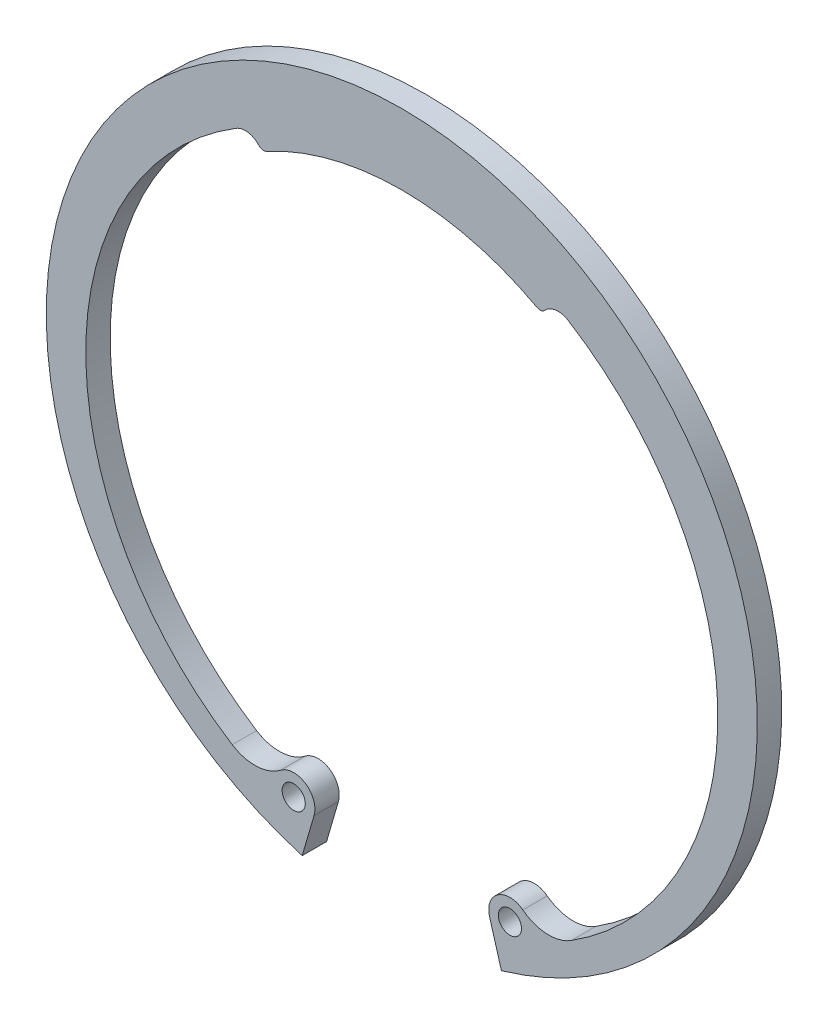
from build123d import *

# Parameters (mm, degrees)
SKETCH1_R           = 1.9
BOSS_EXTRUDE1_DEPTH = 4
BOSS_EXTRUDE2_DEPTH = 4
FILLET1_R           = 3
FILLET2_R           = 1


with BuildPart() as part:
    # Sketch1 → Boss-Extrude1 (new body)
    with BuildSketch(Plane.XY):
        with BuildLine():
            Line((16.350014, -56.012494518), (14.404736199, -49.348288471))
            ThreePointArc((14.404736199, -49.348288471), (15.780421817, -45.505146042), (19.860711038, -45.621311922))
            ThreePointArc((19.860711038, -45.621311922), (23.789076326, -47.057783014), (27.830450892, -45.979453446))
            ThreePointArc((27.830450892, -45.979453446), (0, 49.65), (-27.830450892, -45.979453446))
            ThreePointArc((-27.830450892, -45.979453446), (-23.789076326, -47.057783014), (-19.860711038, -45.621311922))
            ThreePointArc((-19.860711038, -45.621311922), (-15.780421817, -45.505146042), (-14.404736199, -49.348288471))
            Line((-14.404736199, -49.348288471), (-16.350014, -56.012494518))
            ThreePointArc((-16.350014, -56.012494518), (0, 58.35), (16.350014, -56.012494518))
        make_face()
        with Locations((17.740527432, -48.374572984)):
            Circle(SKETCH1_R, mode=Mode.SUBTRACT)
        with Locations((-17.740527432, -48.374572984)):
            Circle(SKETCH1_R, mode=Mode.SUBTRACT)
    extrude(amount=BOSS_EXTRUDE1_DEPTH)

    # Sketch2 → Boss-Extrude2 (add)
    with BuildSketch(Plane(origin=(0, 0, 0), x_dir=(-1, 0, 0), z_dir=(0, 0, -1))):
        with BuildLine():
            Line((23, 40.733405839), (24.5, 43.498463103))
            ThreePointArc((24.5, 43.498463103), (0, 49.65), (-24.5, 43.498463103))
            Line((-24.5, 43.498463103), (-23, 40.733405839))
            ThreePointArc((-23, 40.733405839), (0, 46.778310692), (23, 40.733405839))
        make_face()
    extrude(amount=-BOSS_EXTRUDE2_DEPTH)

    # Fillet1
    fillet1_edges = [part.edges().sort_by_distance(p)[0] for p in [
        (-24.5, 43.498463103, 2),
        (24.5, 43.498463103, 2),
    ]]
    fillet(fillet1_edges, radius=FILLET1_R)

    # Fillet2
    fillet2_edges = [part.edges().sort_by_distance(p)[0] for p in [
        (-23, 40.733405839, 2),
        (23, 40.733405839, 2),
    ]]
    fillet(fillet2_edges, radius=FILLET2_R)


solid = part.part
